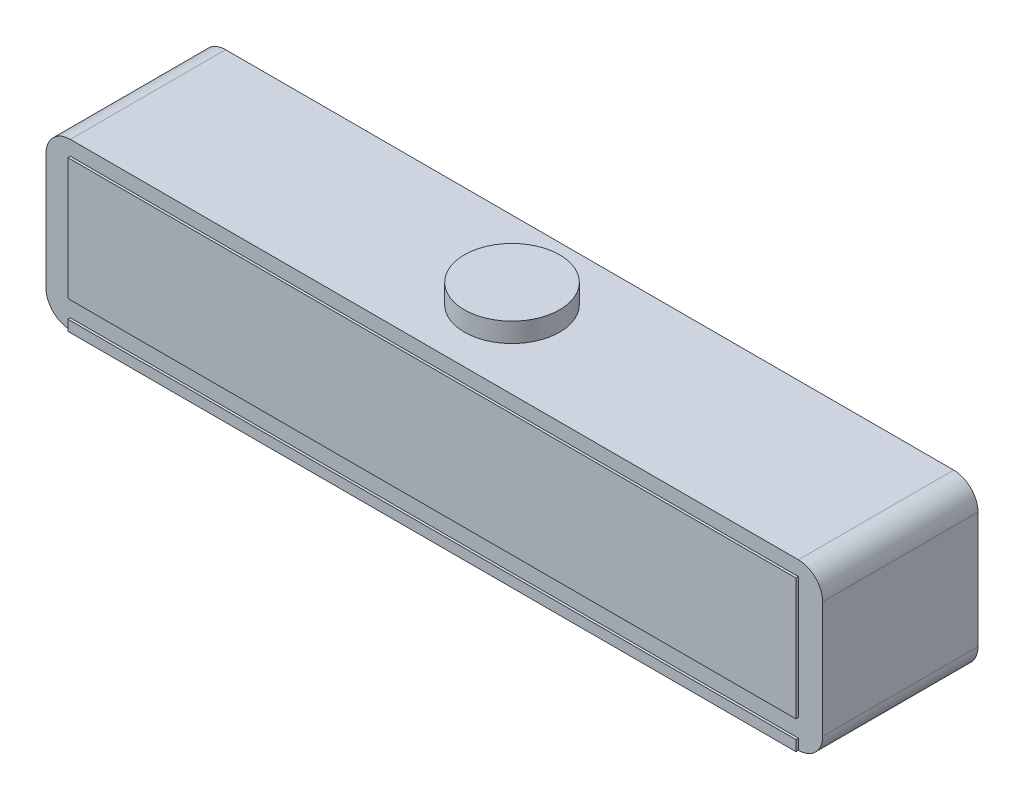
from build123d import *

# Parameters (mm, degrees)
SKETCH_1_W      = 320
SKETCH_1_H      = 64
EXTRUDE_1_DEPTH = 68
FILLET_1_R      = 10
SKETCH_2_R      = 19.624889804
EXTRUDE_2_DEPTH = 8
SKETCH_3_W      = 300
SKETCH_3_H      = 50.287952294
SKETCH_3_H_2    = 4.344723496
EXTRUDE_3_DEPTH = 1


with BuildPart() as part:
    # 草图1 → 凸台-拉伸1 (new body)
    with BuildSketch(Plane(origin=(0, 0, 0), x_dir=(1, 0, 0), z_dir=(0, 1, 0))):
        with Locations((26.422018349, -33.688073394)):
            Rectangle(SKETCH_1_W, SKETCH_1_H)
    extrude(amount=EXTRUDE_1_DEPTH)

    # 圆角1
    fillet_1_edges = [part.edges().sort_by_distance(p)[0] for p in [
        (186.422018349, 68, 33.688073394),
        (-133.577981651, 68, 33.688073394),
        (186.422018349, 0, 33.688073394),
        (-133.577981651, 0, 33.688073394),
    ]]
    fillet(fillet_1_edges, radius=FILLET_1_R)

    # 草图2 → 凸台-拉伸2 (add)
    with BuildSketch(Plane(origin=(0, 68, 0), x_dir=(1, 0, 0), z_dir=(0, 1, 0))):
        with Locations(Location((26.422018349, -33.688073394, 0), (0, 0, 270))):
            Circle(SKETCH_2_R)
    extrude(amount=EXTRUDE_2_DEPTH)

    # 草图3 → 凸台-拉伸3 (add)
    with BuildSketch(Plane.XY.offset(65.688073394)):
        with Locations((26.422018349, 36.856023853)):
            Rectangle(SKETCH_3_W, SKETCH_3_H)
        with Locations((26.422018349, 2.172361748)):
            Rectangle(SKETCH_3_W, SKETCH_3_H_2)
    extrude(amount=EXTRUDE_3_DEPTH)


solid = part.part
